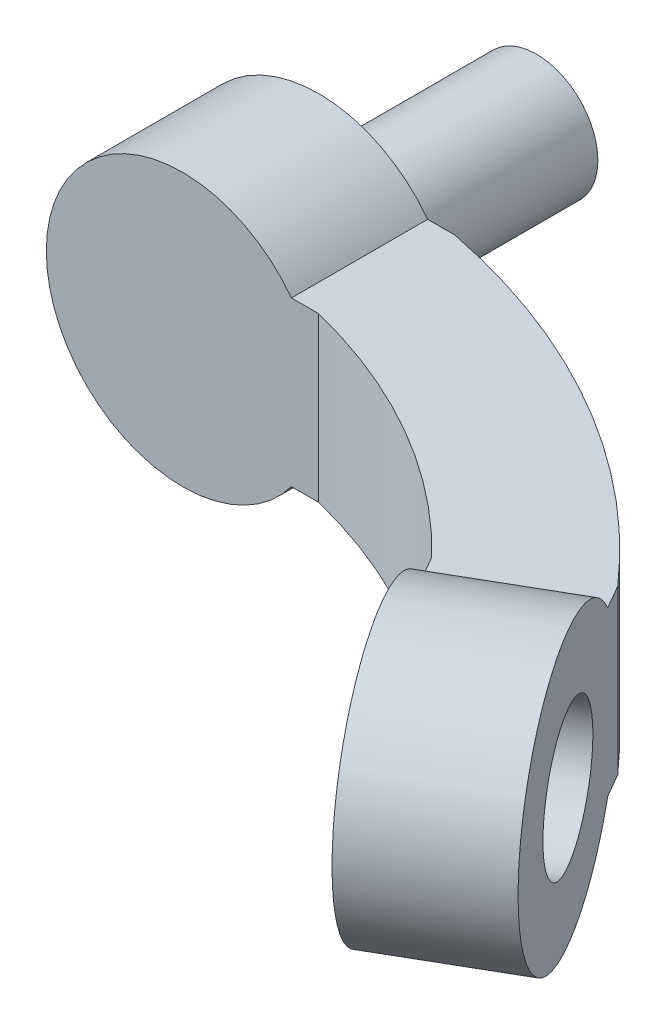
from build123d import *

# Parameters (mm, degrees)
SKETCH_2_R           = 5
EXTRUDE_3_DEPTH      = 5
EXTRUDE_4_DEPTH      = 3
EXTRUDE_4_DEPTH_BACK = 3
SKETCH_4_W           = 5
SKETCH_4_H           = 6
EXTRUDE_5_DEPTH      = 3
SKETCH_5_W           = 5
SKETCH_5_H           = 6
EXTRUDE_6_DEPTH      = 3
SKETCH_6_R           = 2.5
CUT_EXTRUDE_1_DEPTH  = 5
EXTRUDE_START        = -5
SKETCH_7_R           = 2.25
EXTRUDE_7_DEPTH      = 8


with BuildPart() as part:
    # 草图2 → 凸台-拉伸3 (new body)
    with BuildSketch(Plane.XY):
        Circle(SKETCH_2_R)
    extrude(amount=EXTRUDE_3_DEPTH)



with BuildPart() as body_2:
    # 草图3 → 凸台-拉伸4 (new, two sides: drawn at the far end of the back side and taken through both)
    with BuildSketch(Plane(origin=(0, 0, 0), x_dir=(1, 0, 0), z_dir=(0, 1, 0)).offset(-EXTRUDE_4_DEPTH_BACK)):
        with BuildLine():
            ThreePointArc((5, 0), (12.747548784, -2.920597834), (19.150635095, -8.169872981))
            Line((19.150635095, -8.169872981), (14.820508076, -10.669872981))
            ThreePointArc((14.820508076, -10.669872981), (10.307764064, -7.146428929), (5, -5))
            Line((5, -5), (5, 0))
        make_face()
    extrude(amount=EXTRUDE_4_DEPTH + EXTRUDE_4_DEPTH_BACK)



with BuildPart() as body_3:
    # 草图3<3> → 旋转1 (revolve)
    with BuildSketch(Plane(origin=(0, 0, 0), x_dir=(1, 0, 0), z_dir=(0, 1, 0)), mode=Mode.PRIVATE) as revolve_1_sk:
        Polygon((19.150635095, -8.169872981), (14.820508076, -10.669872981), (17.320508076, -15), (21.650635095, -12.5), align=None)
    revolve(revolve_1_sk.sketch.rotate(Axis((0, 0, 25), (0.8660254037844378, 0, -0.5000000000000017)), 180), axis=Axis((0, 0, 25), (0.8660254037844378, 0, -0.5000000000000017)))


with BuildPart() as body_2_1:
    add(body_2.part)

    add(body_3.part)  # 凸台-拉伸5 merges body 3
    # 草图4 → 凸台-拉伸5 (add)
    with BuildSketch(Plane(origin=(8.325317547, 0, 14.419872981), x_dir=(0.8660254037844343, 0, -0.5000000000000075), z_dir=(0.5000000000000075, 0, 0.8660254037844343))):
        with Locations((10, 0)):
            Rectangle(SKETCH_4_W, SKETCH_4_H)
    extrude(amount=EXTRUDE_5_DEPTH)


with BuildPart() as part_1:
    add(part.part)

    add(body_2_1.part)  # 凸台-拉伸6 merges body 2
    # 草图5 → 凸台-拉伸6 (add)
    with BuildSketch(Plane.ZY.offset(-5)):
        with Locations((2.5, 0)):
            Rectangle(SKETCH_5_W, SKETCH_5_H)
    extrude(amount=EXTRUDE_6_DEPTH)

    # 草图6 → 切除-拉伸1 (cut)
    with BuildSketch(Plane(origin=(6.495190528, 0, -3.75), x_dir=(0.5000000000000075, 0, 0.8660254037844343), z_dir=(-0.8660254037844343, 0, 0.5000000000000075))):
        with Locations((21.650635095, 0)):
            Circle(SKETCH_6_R)
    extrude(amount=-CUT_EXTRUDE_1_DEPTH, mode=Mode.SUBTRACT)

    # 草图7 → 凸台-拉伸7 (add)
    with BuildSketch(Plane.XY.offset(5).offset(EXTRUDE_START)):
        Circle(SKETCH_7_R)
    extrude(amount=-EXTRUDE_7_DEPTH)


solid = part_1.part
